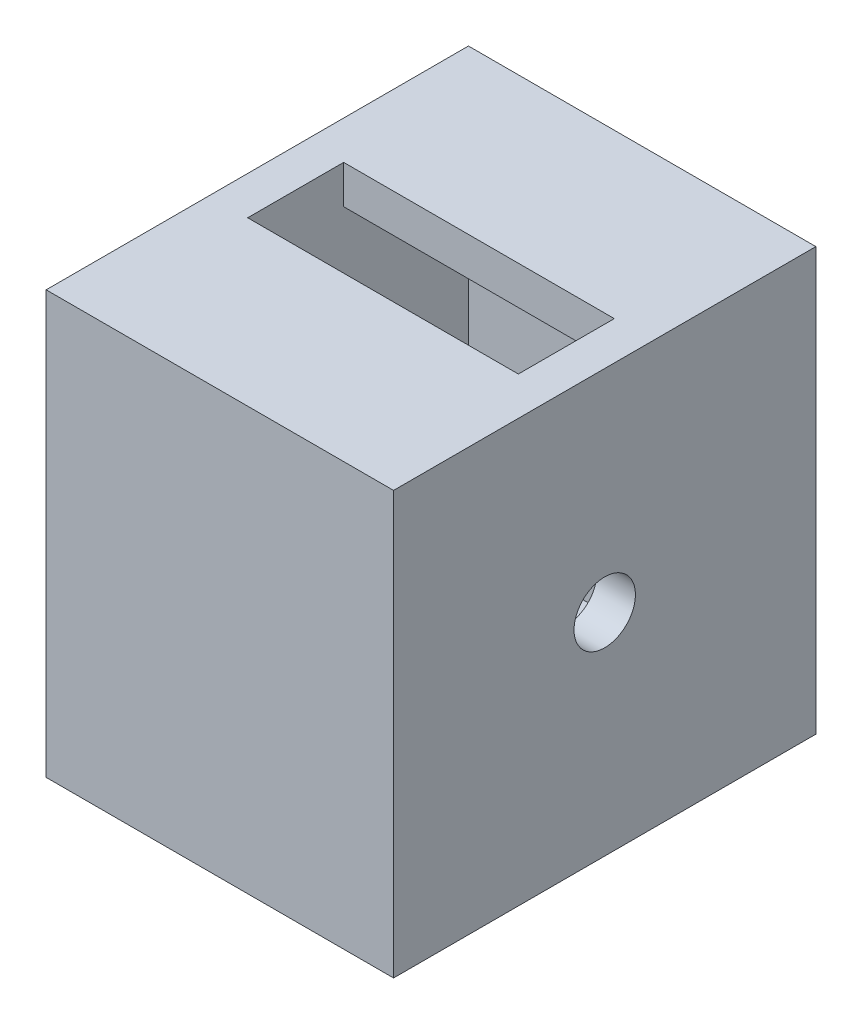
from build123d import *

# Parameters (mm, degrees)
SKETCH2_W           = 22.987
SKETCH2_H           = 27.94
SKETCH2_W_2         = 17.907
SKETCH2_H_2         = 22.86
BOSS_EXTRUDE1_DEPTH = 13.97
SKETCH3_W           = 17.907
SKETCH3_H           = 22.86
BOSS_EXTRUDE2_DEPTH = 2.54
SKETCH4_W           = 17.907
SKETCH4_H           = 8.255
BOSS_EXTRUDE3_DEPTH = 2.54
SKETCH6_R           = 2.032
CUT_EXTRUDE2_DEPTH  = 2.54
SKETCH7_W           = 3.175
SKETCH7_H           = 6.35
CUT_EXTRUDE3_DEPTH  = 2.54


with BuildPart() as part:
    # Sketch2 → Boss-Extrude1 (new, symmetric)
    with BuildSketch(Plane(origin=(0, 0, 0), x_dir=(1, 0, 0), z_dir=(0, 1, 0))):
        Rectangle(SKETCH2_W, SKETCH2_H)
        Rectangle(SKETCH2_W_2, SKETCH2_H_2, mode=Mode.SUBTRACT)
    extrude(amount=BOSS_EXTRUDE1_DEPTH, both=True)

    # Sketch3 → Boss-Extrude2 (add)
    with BuildSketch(Plane.XZ.offset(13.97)):
        Rectangle(SKETCH3_W, SKETCH3_H)
    extrude(amount=-BOSS_EXTRUDE2_DEPTH)

    # Sketch4 → Boss-Extrude3 (add)
    with BuildSketch(Plane(origin=(0, 13.97, 0), x_dir=(1, 0, 0), z_dir=(0, 1, 0))):
        with Locations((0, 7.3025)):
            Rectangle(SKETCH4_W, SKETCH4_H)
        with Locations((0, -7.3025)):
            Rectangle(SKETCH4_W, SKETCH4_H)
    extrude(amount=-BOSS_EXTRUDE3_DEPTH)

    # Sketch6 → Cut-Extrude2 (cut)
    with BuildSketch(Plane(origin=(11.4935, 0, 0), x_dir=(0, 0, -1), z_dir=(1, 0, 0))):
        Circle(SKETCH6_R)
    extrude(amount=-CUT_EXTRUDE2_DEPTH, mode=Mode.SUBTRACT)

    # Sketch7 → Cut-Extrude3 (cut)
    with BuildSketch(Plane(origin=(0, 0, -13.97), x_dir=(-1, 0, 0), z_dir=(0, 0, -1))):
        with Locations((-4.191, 0)):
            Rectangle(SKETCH7_W, SKETCH7_H)
    extrude(amount=-CUT_EXTRUDE3_DEPTH, mode=Mode.SUBTRACT)


solid = part.part
